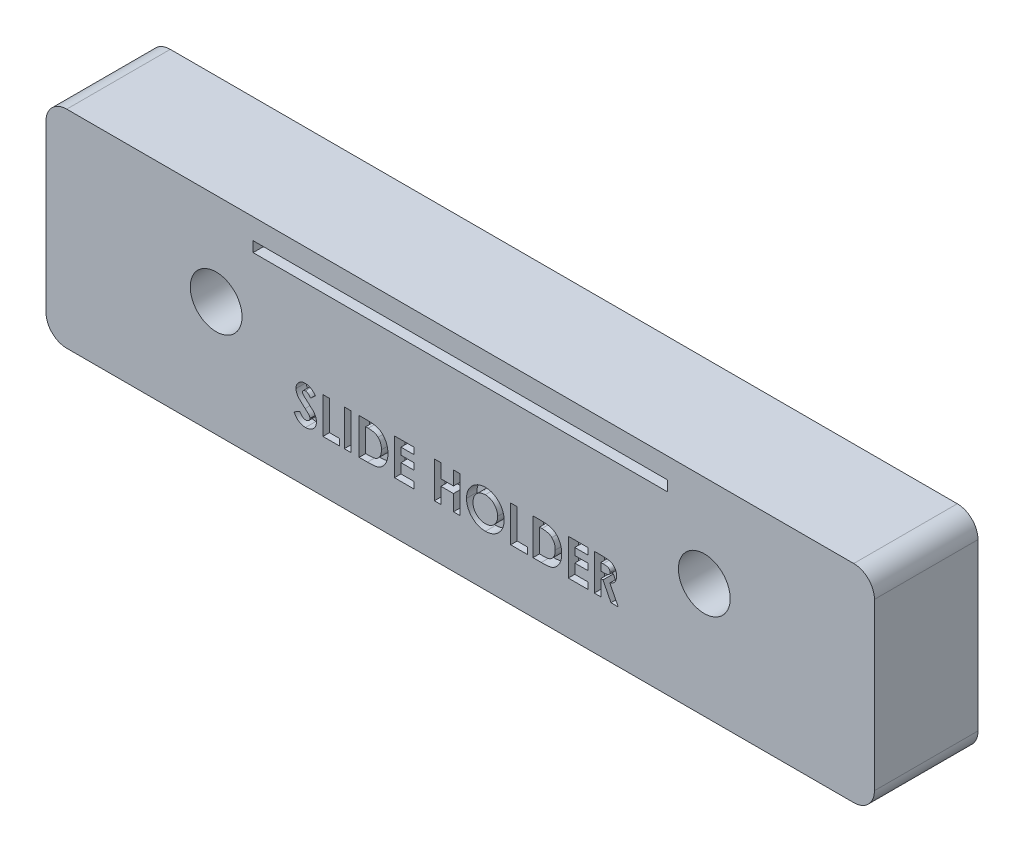
from build123d import *

# Parameters (mm, degrees)
SKETCH1_W           = 80
SKETCH1_H           = 20
BOSS_EXTRUDE1_DEPTH = 10
SKETCH2_R           = 2.5
CUT_EXTRUDE1_DEPTH  = 10
SKETCH3_W           = 40
SKETCH3_H           = 1
CUT_EXTRUDE2_DEPTH  = 47.813641243
SKETCH4_W           = 0.628205128
SKETCH4_H           = 3.5
CUT_EXTRUDE3_DEPTH  = 1
FILLET1_R           = 2


with BuildPart() as part:
    # Sketch1 → Boss-Extrude1 (new body)
    with BuildSketch(Plane.XY):
        with Locations((-0.372188153, 11.484958231)):
            Rectangle(SKETCH1_W, SKETCH1_H)
    extrude(amount=BOSS_EXTRUDE1_DEPTH)

    # Sketch2 → Cut-Extrude1 (cut)
    with BuildSketch(Plane.XY.offset(10)):
        with Locations((-23.942188153, 12.584958231)):
            Circle(SKETCH2_R)
        with Locations(Location((23.197811847, 12.584958231, 0), (0, 0, 180))):
            Circle(SKETCH2_R)
    extrude(amount=-CUT_EXTRUDE1_DEPTH, mode=Mode.SUBTRACT)

    # Sketch3 → Cut-Extrude2 (cut, through all)
    with BuildSketch(Plane.XY.offset(10)):
        with Locations((-0.372188153, 18.984958231)):
            Rectangle(SKETCH3_W, SKETCH3_H)
    extrude(amount=-CUT_EXTRUDE2_DEPTH, mode=Mode.SUBTRACT)

    # Sketch4 → Cut-Extrude3 (cut)
    # profile 1 of 11: a face of its own
    with BuildSketch(Plane.XY.offset(10)):
        with BuildLine():
            Line((-14.349752255, 9.517309993), (-14.819503858, 9.087522333))
            add(Edge.make_bspline(
                [(-14.819503858, 9.087522333), (-14.839626002, 9.11590671), (-14.878257713, 9.170400754), (-14.940875688, 9.243369565), (-15.00321091, 9.30561739), (-15.065840877, 9.356884188), (-15.129320719, 9.396858475), (-15.193540243, 9.425160711), (-15.25813537, 9.443152712), (-15.301533325, 9.445393148), (-15.322909306, 9.446496692)],
                knots=[0, 0, 0, 0, 1.299362458, 2.494594718, 3.587462134, 4.587049575, 5.512617175, 6.380583204, 7.202344345, 8, 8, 8, 8], degree=3))
            add(Edge.make_bspline(
                [(-15.322909306, 9.446496692), (-15.342848209, 9.445797436), (-15.381344991, 9.444447357), (-15.43622501, 9.431027668), (-15.484948273, 9.407867256), (-15.527467227, 9.377583068), (-15.561148512, 9.341097643), (-15.588040406, 9.302833813), (-15.603182803, 9.260599199), (-15.60517584, 9.231590762), (-15.606162511, 9.217229865)],
                knots=[0, 0, 0, 0, 1.185010067, 2.2879431, 3.333075148, 4.379039566, 5.372662701, 6.27520591, 7.14612461, 8, 8, 8, 8], degree=3))
            add(Edge.make_bspline(
                [(-15.606162511, 9.217229865), (-15.605544214, 9.202661878), (-15.60429905, 9.173323975), (-15.592272456, 9.130325625), (-15.574144945, 9.088311232), (-15.556823368, 9.062735072), (-15.547969403, 9.049661756)],
                knots=[0, 0, 0, 0, 0.967525499, 1.948461899, 2.951351359, 4, 4, 4, 4], degree=3))
            add(Edge.make_bspline(
                [(-15.547969403, 9.049661756), (-15.53992019, 9.039500005), (-15.521391965, 9.016108994), (-15.486062436, 8.97906128), (-15.441695968, 8.933674587), (-15.386585244, 8.881509632), (-15.323018063, 8.820690357), (-15.248048005, 8.753607592), (-15.163833033, 8.678183861), (-15.103974983, 8.625661507), (-15.072608826, 8.59813932)],
                knots=[0, 0, 0, 0, 0.473873513, 1.090794244, 1.870441696, 2.795289791, 3.865433203, 5.087734844, 6.473946851, 8, 8, 8, 8], degree=3))
            add(Edge.make_bspline(
                [(-15.072608826, 8.59813932), (-15.043167175, 8.572659057), (-14.987293039, 8.524302811), (-14.907795239, 8.455668883), (-14.837929914, 8.393920612), (-14.776679284, 8.339984707), (-14.724971849, 8.293295256), (-14.682590231, 8.253629086), (-14.649016812, 8.221758422), (-14.629932288, 8.202508522), (-14.621787511, 8.194293166)],
                knots=[0, 0, 0, 0, 1.543621617, 2.929473131, 4.163658386, 5.240097082, 6.164993805, 6.925417477, 7.541396219, 8, 8, 8, 8], degree=3))
            add(Edge.make_bspline(
                [(-14.621787511, 8.194293166), (-14.590887927, 8.160853198), (-14.531488074, 8.096569836), (-14.454289205, 7.996950841), (-14.390752039, 7.899702389), (-14.341598483, 7.802994593), (-14.30447574, 7.705432152), (-14.278303714, 7.604622352), (-14.262629114, 7.499511794), (-14.260888867, 7.42778667), (-14.260008665, 7.391508711)],
                knots=[0, 0, 0, 0, 1.206664779, 2.319633467, 3.337109185, 4.282041471, 5.190008762, 6.099243693, 7.03861361, 8, 8, 8, 8], degree=3))
            add(Edge.make_bspline(
                [(-14.260008665, 7.391508711), (-14.260635171, 7.35616029), (-14.261864397, 7.286805371), (-14.276920065, 7.185314779), (-14.298388563, 7.088183877), (-14.331582628, 6.996469588), (-14.372039357, 6.908666449), (-14.422757711, 6.826142153), (-14.482319463, 6.748061522), (-14.550586376, 6.675820342), (-14.626097688, 6.610266479), (-14.707090746, 6.551908881), (-14.794357542, 6.50372725), (-14.887152482, 6.464053114), (-14.985425894, 6.433495565), (-15.089060706, 6.410910687), (-15.198215434, 6.3973556), (-15.27285701, 6.395938576), (-15.310990236, 6.395214641)],
                knots=[0, 0, 0, 0, 1.043214005, 2.046824704, 3.02475056, 3.976699089, 4.921714032, 5.875962561, 6.831408892, 7.817874052, 8.806269674, 9.781291748, 10.760897367, 11.74438705, 12.757449933, 13.795994037, 14.874007457, 16, 16, 16, 16], degree=3))
            add(Edge.make_bspline(
                [(-15.310990236, 6.395214641), (-15.340924494, 6.395745695), (-15.400211491, 6.396797485), (-15.487591563, 6.405384482), (-15.5719669, 6.419242981), (-15.65324246, 6.43910635), (-15.731784406, 6.464275933), (-15.807595962, 6.495019614), (-15.880153776, 6.531813909), (-15.950006855, 6.57390218), (-16.016815626, 6.622772208), (-16.081424861, 6.677424859), (-16.143192799, 6.738700717), (-16.202416099, 6.806454866), (-16.258715834, 6.88087917), (-16.313934896, 6.960937133), (-16.365619184, 7.048114521), (-16.397546867, 7.109270164), (-16.413854819, 7.140507109)],
                knots=[0, 0, 0, 0, 1.016823716, 2.013894106, 2.979844003, 3.91962641, 4.853723003, 5.779685073, 6.695824784, 7.614987388, 8.547259901, 9.504950863, 10.487499108, 11.500346958, 12.559593716, 13.656357062, 14.802919212, 16, 16, 16, 16], degree=3))
            Line((-16.413854819, 7.140507109), (-15.861370845, 7.472137718))
            add(Edge.make_bspline(
                [(-15.861370845, 7.472137718), (-15.840972034, 7.436679704), (-15.801865771, 7.368703661), (-15.735596552, 7.277369232), (-15.66770712, 7.199156412), (-15.596627932, 7.135447618), (-15.523223285, 7.085390981), (-15.447138618, 7.049617036), (-15.368320474, 7.027473004), (-15.314633135, 7.024768707), (-15.287853217, 7.023419769)],
                knots=[0, 0, 0, 0, 1.283663364, 2.460892379, 3.537111102, 4.529833553, 5.449777664, 6.316464042, 7.160231139, 8, 8, 8, 8], degree=3))
            add(Edge.make_bspline(
                [(-15.287853217, 7.023419769), (-15.260614206, 7.024521385), (-15.207766557, 7.026658679), (-15.132333302, 7.046400227), (-15.063173237, 7.077395904), (-15.003391788, 7.121622461), (-14.952772626, 7.17266663), (-14.915412779, 7.229455602), (-14.891943071, 7.290899899), (-14.889461754, 7.333583149), (-14.888213794, 7.355050378)],
                knots=[0, 0, 0, 0, 1.13588714, 2.203786484, 3.234766741, 4.283437687, 5.291419208, 6.222934724, 7.106237994, 8, 8, 8, 8], degree=3))
            add(Edge.make_bspline(
                [(-14.888213794, 7.355050378), (-14.889366234, 7.375022141), (-14.891707306, 7.415592866), (-14.908950922, 7.475915011), (-14.935907953, 7.536209722), (-14.967800022, 7.585665076), (-15.000254195, 7.627072702), (-15.031287705, 7.662950538), (-15.06907831, 7.702589265), (-15.113530191, 7.746038746), (-15.164056023, 7.793681479), (-15.220698365, 7.845512797), (-15.284105834, 7.901076128), (-15.328922359, 7.938925321), (-15.352356422, 7.958716243)],
                knots=[0, 0, 0, 0, 0.916159276, 1.861089862, 2.860218735, 3.940849679, 4.552606315, 5.27541173, 6.11797699, 7.06649574, 8.129236253, 9.306560635, 10.591630461, 12, 12, 12, 12], degree=3))
            add(Edge.make_bspline(
                [(-15.352356422, 7.958716243), (-15.396905508, 7.996409042), (-15.482408689, 8.068752932), (-15.603235531, 8.175602581), (-15.712111335, 8.275463367), (-15.808095732, 8.36956979), (-15.892411711, 8.456183922), (-15.964488248, 8.536009275), (-16.023533551, 8.609661594), (-16.085665999, 8.696897837), (-16.144704248, 8.803201193), (-16.195730049, 8.931096453), (-16.228833434, 9.058975486), (-16.232542208, 9.144826424), (-16.23436764, 9.187081628)],
                knots=[0, 0, 0, 0, 1.345494975, 2.582412109, 3.71882943, 4.751509156, 5.681369928, 6.505683931, 7.230279997, 7.856715994, 8.973648664, 10.023341002, 11.027102913, 12, 12, 12, 12], degree=3))
            add(Edge.make_bspline(
                [(-16.23436764, 9.187081628), (-16.233608445, 9.21704675), (-16.232112751, 9.27608126), (-16.218770923, 9.362882906), (-16.198831054, 9.4466392), (-16.169872639, 9.527044562), (-16.132288114, 9.603998281), (-16.086643167, 9.677877078), (-16.03222902, 9.748000989), (-15.97090795, 9.814323527), (-15.903347831, 9.87493478), (-15.831151258, 9.928430283), (-15.75472687, 9.973613363), (-15.674542192, 10.011096009), (-15.590100355, 10.039786593), (-15.502023437, 10.060123909), (-15.410185107, 10.072219896), (-15.347718657, 10.073864205), (-15.315898088, 10.07470182)],
                knots=[0, 0, 0, 0, 1.010766082, 1.991317756, 2.957454644, 3.913069143, 4.869106762, 5.843196583, 6.838735724, 7.860187025, 8.887984031, 9.89767229, 10.887916223, 11.879572884, 12.879850636, 13.892031539, 14.926195476, 16, 16, 16, 16], degree=3))
            add(Edge.make_bspline(
                [(-15.315898088, 10.07470182), (-15.274660206, 10.073193251), (-15.192509958, 10.07018802), (-15.071048447, 10.046688095), (-14.952409922, 10.009731987), (-14.856808774, 9.965148509), (-14.780740726, 9.921960473), (-14.722441673, 9.882198369), (-14.663119248, 9.836648743), (-14.602295053, 9.785168054), (-14.541099296, 9.72678634), (-14.477791889, 9.662893423), (-14.413235472, 9.592937118), (-14.371284036, 9.542960658), (-14.349752255, 9.517309993)],
                knots=[0, 0, 0, 0, 1.282922637, 2.555718331, 3.837320111, 5.142675274, 5.830281639, 6.55870424, 7.337177975, 8.157850921, 9.037902056, 9.96903443, 10.957596896, 12, 12, 12, 12], degree=3))
        make_face()
    # profile 2 of 11: a face of its own
    with BuildSketch(Plane.XY.offset(10)):
        Polygon((-13.631803537, 9.984958231), (-13.003598409, 9.984958231), (-13.003598409, 7.113163359), (-12.016418922, 7.113163359), (-12.016418922, 6.484958231), (-13.631803537, 6.484958231), align=None)
    # profile 3 of 11: a face of its own
    with BuildSketch(Plane.XY.offset(10)):
        with Locations((-11.253598409, 8.234958231)):
            Rectangle(SKETCH4_W, SKETCH4_H)
    # profile 4 of 11: a face of its own
    with BuildSketch(Plane.XY.offset(10)):
        with BuildLine():
            Line((-10.131803537, 9.984958231), (-9.340237031, 9.984958231))
            add(Edge.make_bspline(
                [(-9.340237031, 9.984958231), (-9.278525317, 9.984526845), (-9.159235876, 9.983692971), (-8.986409077, 9.974297216), (-8.825702145, 9.959847212), (-8.677011488, 9.939968613), (-8.540641944, 9.913663783), (-8.41676936, 9.880669529), (-8.304977988, 9.842583152), (-8.204042061, 9.797766801), (-8.111897268, 9.745515387), (-8.024402846, 9.687311506), (-7.941730589, 9.621022981), (-7.862720321, 9.547928649), (-7.788391688, 9.466691271), (-7.717506852, 9.378656434), (-7.651801394, 9.282547511), (-7.589289181, 9.18066889), (-7.532755202, 9.07258882), (-7.483444154, 8.959227255), (-7.44213599, 8.841313719), (-7.408570967, 8.718722549), (-7.38181577, 8.591860707), (-7.363095698, 8.460472201), (-7.351522763, 8.324678672), (-7.350348786, 8.232644731), (-7.349752255, 8.185879705)],
                knots=[0, 0, 0, 0, 1.44355588, 2.790409838, 4.047694926, 5.217575253, 6.298404546, 7.294384826, 8.214239204, 9.058592145, 9.873746385, 10.689560431, 11.514393297, 12.350027578, 13.205127629, 14.088021785, 14.991911688, 15.926770944, 16.882954281, 17.842803888, 18.816321264, 19.80318086, 20.814351908, 21.847355356, 22.906180909, 24, 24, 24, 24], degree=3))
            add(Edge.make_bspline(
                [(-7.349752255, 8.185879705), (-7.351314295, 8.119891209), (-7.354389262, 7.989988993), (-7.380291065, 7.799358988), (-7.422183052, 7.616621114), (-7.48108699, 7.44320482), (-7.554112105, 7.280654401), (-7.641348783, 7.131836367), (-7.741517929, 6.997549498), (-7.853452569, 6.878462432), (-7.974650522, 6.776105485), (-8.100599634, 6.68844425), (-8.232526881, 6.619316051), (-8.348773223, 6.575478436), (-8.449573303, 6.548215232), (-8.538074683, 6.532102416), (-8.638603221, 6.517325992), (-8.752096258, 6.505907089), (-8.878055925, 6.495724234), (-9.016984298, 6.490191267), (-9.168431567, 6.485594192), (-9.273626014, 6.485175772), (-9.32831796, 6.484958231)],
                knots=[0, 0, 0, 0, 1.315458931, 2.589557908, 3.828601765, 5.048913369, 6.235739168, 7.376350998, 8.481830359, 9.569842114, 10.627874879, 11.640079404, 12.624025415, 13.590060155, 14.111227486, 14.704434459, 15.382649715, 16.137166398, 16.978595427, 17.902333227, 18.909396075, 20, 20, 20, 20], degree=3))
            Line((-9.32831796, 6.484958231), (-10.131803537, 6.484958231))
            Line((-10.131803537, 6.484958231), (-10.131803537, 9.984958231))
        make_face()
        with BuildLine():
            Line((-9.503598409, 9.356753102), (-9.503598409, 7.113163359))
            Line((-9.503598409, 7.113163359), (-9.175473409, 7.113163359))
            add(Edge.make_bspline(
                [(-9.175473409, 7.113163359), (-9.136431573, 7.1132349), (-9.061341126, 7.113372496), (-8.952927517, 7.11992635), (-8.852672419, 7.126504612), (-8.760851809, 7.138990373), (-8.676797445, 7.152898632), (-8.601664016, 7.172253879), (-8.533902693, 7.192584927), (-8.474341169, 7.21846887), (-8.419787665, 7.247602971), (-8.369277353, 7.281736947), (-8.320520759, 7.319641441), (-8.274429429, 7.362431277), (-8.230828917, 7.409539837), (-8.189977191, 7.461209851), (-8.15132899, 7.517283672), (-8.115876339, 7.578057777), (-8.083479517, 7.642890377), (-8.054739905, 7.711153473), (-8.030910527, 7.783415551), (-8.011105006, 7.85900015), (-7.996951715, 7.93856532), (-7.985242567, 8.021521734), (-7.97920616, 8.108198056), (-7.978377701, 8.167175523), (-7.977957383, 8.197097654)],
                knots=[0, 0, 0, 0, 1.50275155, 2.890291501, 4.180787663, 5.369391935, 6.45668281, 7.458360028, 8.354766181, 9.177074746, 9.954075863, 10.732690366, 11.5210699, 12.329727389, 13.151100085, 13.990027547, 14.863562427, 15.770965086, 16.696477834, 17.652329173, 18.619756807, 19.62365428, 20.657822005, 21.729286259, 22.847956731, 24, 24, 24, 24], degree=3))
            add(Edge.make_bspline(
                [(-7.977957383, 8.197097654), (-7.978794513, 8.24295049), (-7.980426852, 8.332359969), (-7.996168771, 8.462586827), (-8.021793612, 8.585214922), (-8.058357792, 8.699789149), (-8.104448074, 8.806631522), (-8.162140805, 8.90483686), (-8.228953114, 8.996054876), (-8.281786464, 9.049566291), (-8.308185749, 9.076304384)],
                knots=[0, 0, 0, 0, 1.13821349, 2.219428113, 3.251817212, 4.244760574, 5.201143372, 6.134805572, 7.068016741, 8, 8, 8, 8], degree=3))
            add(Edge.make_bspline(
                [(-8.308185749, 9.076304384), (-8.334217943, 9.099088855), (-8.387385752, 9.145623556), (-8.480730952, 9.201384028), (-8.583592529, 9.250375068), (-8.698323646, 9.289219499), (-8.823815478, 9.319939331), (-8.960815458, 9.341126048), (-9.10858992, 9.354740408), (-9.210964624, 9.356067831), (-9.263814755, 9.356753102)],
                knots=[0, 0, 0, 0, 0.813307809, 1.661089106, 2.549956539, 3.493439533, 4.508053171, 5.589449661, 6.755572447, 8, 8, 8, 8], degree=3))
            Line((-9.263814755, 9.356753102), (-9.503598409, 9.356753102))
        make_face(mode=Mode.SUBTRACT)
    # profile 5 of 11: a face of its own
    with BuildSketch(Plane.XY.offset(10)):
        Polygon((-6.721547127, 9.984958231), (-4.836931742, 9.984958231), (-4.836931742, 9.356753102), (-6.093341999, 9.356753102), (-6.093341999, 8.683676179), (-4.836931742, 8.683676179), (-4.836931742, 8.055471051), (-6.093341999, 8.055471051), (-6.093341999, 7.113163359), (-4.836931742, 7.113163359), (-4.836931742, 6.484958231), (-6.721547127, 6.484958231), align=None)
    # profile 6 of 11: a face of its own
    with BuildSketch(Plane.XY.offset(10)):
        Polygon((-2.862572768, 9.984958231), (-2.23436764, 9.984958231), (-2.23436764, 8.638804384), (-1.022829178, 8.638804384), (-1.022829178, 9.984958231), (-0.39462405, 9.984958231), (-0.39462405, 6.484958231), (-1.022829178, 6.484958231), (-1.022829178, 8.010599256), (-2.23436764, 8.010599256), (-2.23436764, 6.484958231), (-2.862572768, 6.484958231), align=None)
    # profile 7 of 11: a face of its own
    with BuildSketch(Plane.XY.offset(10)):
        with BuildLine():
            add(Edge.make_bspline(
                [(2.057899989, 10.07470182), (2.118751778, 10.073126259), (2.238886993, 10.070015743), (2.415562542, 10.044087165), (2.585822101, 10.001840266), (2.749588678, 9.94311402), (2.906452222, 9.866317822), (3.056966042, 9.773628896), (3.200591005, 9.663297792), (3.335855357, 9.537898354), (3.460864014, 9.40153194), (3.569184088, 9.254709252), (3.661555474, 9.101234612), (3.738113125, 8.940696782), (3.796426027, 8.771983959), (3.837346602, 8.595956357), (3.863636044, 8.412664053), (3.866659734, 8.287866977), (3.868196463, 8.224441404)],
                knots=[0, 0, 0, 0, 1.014329547, 2.002516266, 2.970391464, 3.935626869, 4.897733899, 5.877609409, 6.878433252, 7.912639331, 8.949961323, 9.958554974, 10.949718813, 11.932905612, 12.9188844, 13.919928257, 14.942845884, 16, 16, 16, 16], degree=3))
            add(Edge.make_bspline(
                [(3.868196463, 8.224441404), (3.866559913, 8.16173049), (3.863335039, 8.038156623), (3.838419852, 7.85655343), (3.796810169, 7.68241145), (3.7394863, 7.515336509), (3.664317115, 7.35613786), (3.573747072, 7.203799042), (3.4653862, 7.059733797), (3.343186846, 6.924019434), (3.208655961, 6.800829529), (3.066166398, 6.692268638), (2.916376085, 6.600278235), (2.759504267, 6.524900457), (2.595214541, 6.46640254), (2.423912721, 6.425128009), (2.245609409, 6.400044643), (2.124354509, 6.396840833), (2.062807841, 6.395214641)],
                knots=[0, 0, 0, 0, 1.051557043, 2.072126891, 3.067553643, 4.050577992, 5.02905126, 6.015227836, 7.017913613, 8.04756643, 9.074058332, 10.072836633, 11.047628519, 12.017157415, 12.98668631, 13.966869689, 14.968021931, 16, 16, 16, 16], degree=3))
            add(Edge.make_bspline(
                [(2.062807841, 6.395214641), (1.998437406, 6.396673416), (1.871958299, 6.399539709), (1.68685556, 6.426796848), (1.509511142, 6.467855622), (1.34141484, 6.529133638), (1.180854737, 6.605736312), (1.029010515, 6.700077097), (0.885933204, 6.812000088), (0.752443519, 6.938638896), (0.63150154, 7.077209529), (0.524746521, 7.223597113), (0.434696295, 7.376683378), (0.361347566, 7.53653997), (0.303522374, 7.70217342), (0.262733272, 7.874592483), (0.238638176, 8.053383636), (0.235281869, 8.174822161), (0.233581078, 8.236360474)],
                knots=[0, 0, 0, 0, 1.067978421, 2.098431617, 3.099715153, 4.085208694, 5.062210972, 6.048429807, 7.046490867, 8.072918869, 9.098532598, 10.095778865, 11.076610158, 12.041847152, 13.011192615, 13.984257998, 14.978533688, 16, 16, 16, 16], degree=3))
            add(Edge.make_bspline(
                [(0.233581078, 8.236360474), (0.234114884, 8.27776023), (0.235175737, 8.360035525), (0.247954826, 8.481963312), (0.26635304, 8.601511233), (0.293563126, 8.718202648), (0.326616426, 8.832860761), (0.369441644, 8.944418305), (0.418188333, 9.054067022), (0.475144249, 9.160511823), (0.53847372, 9.262773328), (0.607571811, 9.36036915), (0.682612269, 9.452119214), (0.763353364, 9.538626463), (0.850073339, 9.619322279), (0.941631484, 9.695349023), (1.039803493, 9.764687155), (1.142440689, 9.829030051), (1.248964427, 9.887214215), (1.358941058, 9.936738836), (1.470104848, 9.979987843), (1.583940794, 10.014121873), (1.699228942, 10.041923682), (1.817200912, 10.060309496), (1.936790894, 10.073088231), (2.017434485, 10.074162681), (2.057899989, 10.07470182)],
                knots=[0, 0, 0, 0, 1.034744296, 2.056386356, 3.06226378, 4.057406941, 5.050368692, 6.043467995, 7.042652155, 8.049140477, 9.059438543, 10.048523776, 11.036952808, 12.020949711, 13.004946614, 13.997082645, 14.994316842, 16.007702937, 17.024872941, 18.026463647, 19.021641123, 20.005082605, 20.995858141, 21.984425357, 22.988620895, 24, 24, 24, 24], degree=3))
        make_face()
        with BuildLine():
            add(Edge.make_bspline(
                [(2.048084283, 9.446496692), (2.007131037, 9.445397825), (1.926305717, 9.4432291), (1.807749692, 9.42670635), (1.693931721, 9.40031764), (1.585482743, 9.362093917), (1.481932729, 9.313444819), (1.383098118, 9.254540331), (1.290347565, 9.183355678), (1.20244433, 9.103712446), (1.123038223, 9.014971583), (1.052880422, 8.919870656), (0.994169643, 8.818568482), (0.944998997, 8.712006135), (0.907984399, 8.598985349), (0.881620011, 8.480391428), (0.864958701, 8.356020029), (0.862858522, 8.271236208), (0.861786206, 8.227947013)],
                knots=[0, 0, 0, 0, 1.033739768, 2.040188636, 3.016340934, 3.979330865, 4.937572243, 5.900995986, 6.878200029, 7.884839167, 8.891893314, 9.879764717, 10.863503415, 11.843163062, 12.837761627, 13.859916423, 14.907309254, 16, 16, 16, 16], degree=3))
            add(Edge.make_bspline(
                [(0.861786206, 8.227947013), (0.863207934, 8.179972846), (0.865994284, 8.085951429), (0.885599381, 7.948795519), (0.919141751, 7.819265375), (0.967576281, 7.697994508), (1.027647806, 7.583636298), (1.102247105, 7.477592367), (1.190166024, 7.379227773), (1.257898046, 7.321798425), (1.292274989, 7.292650538)],
                knots=[0, 0, 0, 0, 1.078454662, 2.113592447, 3.107694534, 4.079536787, 5.043276885, 6.005368276, 6.987637804, 8, 8, 8, 8], degree=3))
            add(Edge.make_bspline(
                [(1.292274989, 7.292650538), (1.320436267, 7.271117199), (1.376124346, 7.22853567), (1.465014644, 7.173958705), (1.556554147, 7.127180801), (1.651433636, 7.089384809), (1.749452731, 7.059655117), (1.85059799, 7.038835902), (1.954726098, 7.025770044), (2.025142405, 7.024208427), (2.060704476, 7.023419769)],
                knots=[0, 0, 0, 0, 1.023928204, 2.024787132, 3.009472467, 3.9914905, 4.972207045, 5.96565515, 6.972602802, 8, 8, 8, 8], degree=3))
            add(Edge.make_bspline(
                [(2.060704476, 7.023419769), (2.10095353, 7.024527954), (2.18014481, 7.026708342), (2.29649385, 7.043027688), (2.407959765, 7.070645913), (2.515234544, 7.108534324), (2.618008854, 7.157794254), (2.715780409, 7.218525774), (2.80872063, 7.28998318), (2.896511877, 7.370672302), (2.976757226, 7.459762743), (3.046768622, 7.555370928), (3.107346111, 7.655390324), (3.155494252, 7.761236552), (3.193971213, 7.871910475), (3.220018293, 7.987902243), (3.236820353, 8.108733694), (3.238921123, 8.190963766), (3.239991335, 8.232854865)],
                knots=[0, 0, 0, 0, 1.026359118, 2.019393844, 2.989460624, 3.950973911, 4.916101784, 5.890408035, 6.881132271, 7.902007068, 8.92769091, 9.933912415, 10.920395702, 11.90457117, 12.894218921, 13.903490204, 14.931958862, 16, 16, 16, 16], degree=3))
            add(Edge.make_bspline(
                [(3.239991335, 8.232854865), (3.238884094, 8.274505079), (3.236704658, 8.356487173), (3.220356589, 8.477007967), (3.192913512, 8.592487665), (3.154911326, 8.703114858), (3.106384547, 8.808998001), (3.046376261, 8.909764747), (2.975097031, 9.005317679), (2.894187343, 9.095005641), (2.806122121, 9.177423132), (2.711575305, 9.248946533), (2.613192423, 9.311098094), (2.50871609, 9.359785117), (2.400283804, 9.398573965), (2.287233907, 9.427138629), (2.169138215, 9.443113027), (2.088795273, 9.44535875), (2.048084283, 9.446496692)],
                knots=[0, 0, 0, 0, 1.055025985, 2.07665775, 3.074803781, 4.057872707, 5.035505728, 6.020516407, 7.023567878, 8.050795229, 9.077271434, 10.074415901, 11.050397877, 12.019801805, 12.988065821, 13.964604439, 14.968634123, 16, 16, 16, 16], degree=3))
        make_face(mode=Mode.SUBTRACT)
    # profile 8 of 11: a face of its own
    with BuildSketch(Plane.XY.offset(10)):
        Polygon((4.496401591, 9.984958231), (5.124606719, 9.984958231), (5.124606719, 7.113163359), (6.111786206, 7.113163359), (6.111786206, 6.484958231), (4.496401591, 6.484958231), align=None)
    # profile 9 of 11: a face of its own
    with BuildSketch(Plane.XY.offset(10)):
        with BuildLine():
            Line((6.650247745, 9.984958231), (7.441814251, 9.984958231))
            add(Edge.make_bspline(
                [(7.441814251, 9.984958231), (7.503525965, 9.984526845), (7.622815406, 9.983692971), (7.795642205, 9.974297216), (7.956349137, 9.959847212), (8.105039794, 9.939968613), (8.241409338, 9.913663783), (8.365281923, 9.880669529), (8.477073294, 9.842583152), (8.578009221, 9.797766801), (8.670154014, 9.745515387), (8.757648436, 9.687311506), (8.840320693, 9.621022981), (8.919330961, 9.547928649), (8.993659594, 9.466691271), (9.06454443, 9.378656434), (9.130249888, 9.282547511), (9.192762101, 9.18066889), (9.24929608, 9.07258882), (9.298607128, 8.959227255), (9.339915292, 8.841313719), (9.373480315, 8.718722549), (9.400235512, 8.591860707), (9.418955584, 8.460472201), (9.430528519, 8.324678672), (9.431702496, 8.232644731), (9.432299027, 8.185879705)],
                knots=[0, 0, 0, 0, 1.44355588, 2.790409838, 4.047694926, 5.217575253, 6.298404546, 7.294384826, 8.214239204, 9.058592145, 9.873746385, 10.689560431, 11.514393297, 12.350027578, 13.205127629, 14.088021785, 14.991911688, 15.926770944, 16.882954281, 17.842803888, 18.816321264, 19.80318086, 20.814351908, 21.847355356, 22.906180909, 24, 24, 24, 24], degree=3))
            add(Edge.make_bspline(
                [(9.432299027, 8.185879705), (9.430736987, 8.119891209), (9.42766202, 7.989988993), (9.401760217, 7.799358988), (9.35986823, 7.616621114), (9.300964292, 7.44320482), (9.227939177, 7.280654401), (9.140702499, 7.131836367), (9.040533353, 6.997549498), (8.928598713, 6.878462432), (8.80740076, 6.776105485), (8.681451648, 6.68844425), (8.549524401, 6.619316051), (8.43327806, 6.575478436), (8.332477979, 6.548215232), (8.243976599, 6.532102416), (8.143448061, 6.517325992), (8.029955024, 6.505907089), (7.903995357, 6.495724234), (7.765066984, 6.490191267), (7.613619715, 6.485594192), (7.508425268, 6.485175772), (7.453733322, 6.484958231)],
                knots=[0, 0, 0, 0, 1.315458931, 2.589557908, 3.828601765, 5.048913369, 6.235739168, 7.376350998, 8.481830359, 9.569842114, 10.627874879, 11.640079404, 12.624025415, 13.590060155, 14.111227486, 14.704434459, 15.382649715, 16.137166398, 16.978595427, 17.902333227, 18.909396075, 20, 20, 20, 20], degree=3))
            Line((7.453733322, 6.484958231), (6.650247745, 6.484958231))
            Line((6.650247745, 6.484958231), (6.650247745, 9.984958231))
        make_face()
        with BuildLine():
            Line((7.278452873, 9.356753102), (7.278452873, 7.113163359))
            Line((7.278452873, 7.113163359), (7.606577873, 7.113163359))
            add(Edge.make_bspline(
                [(7.606577873, 7.113163359), (7.645619709, 7.1132349), (7.720710156, 7.113372496), (7.829123765, 7.11992635), (7.929378863, 7.126504612), (8.021199473, 7.138990373), (8.105253837, 7.152898632), (8.180387267, 7.172253879), (8.248148589, 7.192584927), (8.307710113, 7.21846887), (8.362263617, 7.247602971), (8.412773929, 7.281736947), (8.461530523, 7.319641441), (8.507621853, 7.362431277), (8.551222365, 7.409539837), (8.592074091, 7.461209851), (8.630722292, 7.517283672), (8.666174943, 7.578057777), (8.698571765, 7.642890377), (8.727311377, 7.711153473), (8.751140756, 7.783415551), (8.770946276, 7.85900015), (8.785099567, 7.93856532), (8.796808715, 8.021521734), (8.802845122, 8.108198056), (8.803673581, 8.167175523), (8.804093899, 8.197097654)],
                knots=[0, 0, 0, 0, 1.50275155, 2.890291501, 4.180787663, 5.369391935, 6.45668281, 7.458360028, 8.354766181, 9.177074746, 9.954075863, 10.732690366, 11.5210699, 12.329727389, 13.151100085, 13.990027547, 14.863562427, 15.770965086, 16.696477834, 17.652329173, 18.619756807, 19.62365428, 20.657822005, 21.729286259, 22.847956731, 24, 24, 24, 24], degree=3))
            add(Edge.make_bspline(
                [(8.804093899, 8.197097654), (8.803256769, 8.24295049), (8.80162443, 8.332359969), (8.785882511, 8.462586827), (8.76025767, 8.585214922), (8.72369349, 8.699789149), (8.677603208, 8.806631522), (8.619910477, 8.90483686), (8.553098168, 8.996054876), (8.500264818, 9.049566291), (8.473865533, 9.076304384)],
                knots=[0, 0, 0, 0, 1.13821349, 2.219428113, 3.251817212, 4.244760574, 5.201143372, 6.134805572, 7.068016741, 8, 8, 8, 8], degree=3))
            add(Edge.make_bspline(
                [(8.473865533, 9.076304384), (8.447833339, 9.099088855), (8.39466553, 9.145623556), (8.30132033, 9.201384028), (8.198458753, 9.250375068), (8.083727636, 9.289219499), (7.958235804, 9.319939331), (7.821235824, 9.341126048), (7.673461363, 9.354740408), (7.571086658, 9.356067831), (7.518236527, 9.356753102)],
                knots=[0, 0, 0, 0, 0.813307809, 1.661089106, 2.549956539, 3.493439533, 4.508053171, 5.589449661, 6.755572447, 8, 8, 8, 8], degree=3))
            Line((7.518236527, 9.356753102), (7.278452873, 9.356753102))
        make_face(mode=Mode.SUBTRACT)
    # profile 10 of 11: a face of its own
    with BuildSketch(Plane.XY.offset(10)):
        Polygon((10.060504155, 9.984958231), (11.94511954, 9.984958231), (11.94511954, 9.356753102), (10.688709283, 9.356753102), (10.688709283, 8.683676179), (11.94511954, 8.683676179), (11.94511954, 8.055471051), (10.688709283, 8.055471051), (10.688709283, 7.113163359), (11.94511954, 7.113163359), (11.94511954, 6.484958231), (10.060504155, 6.484958231), align=None)
    # profile 11 of 11: a face of its own
    with BuildSketch(Plane.XY.offset(10)):
        with BuildLine():
            Line((12.573324668, 9.984958231), (13.305295822, 9.984958231))
            add(Edge.make_bspline(
                [(13.305295822, 9.984958231), (13.353678892, 9.984786498), (13.446733166, 9.984456209), (13.580912345, 9.979245119), (13.704174374, 9.97199346), (13.816701753, 9.960927236), (13.918446342, 9.946254761), (14.009510111, 9.92895834), (14.089890399, 9.90924536), (14.160265103, 9.884681432), (14.223774794, 9.856973694), (14.282974655, 9.825136994), (14.339170723, 9.789525846), (14.39198739, 9.749203222), (14.441883643, 9.704894517), (14.488953615, 9.65655513), (14.532532163, 9.603775162), (14.572349449, 9.546888118), (14.608639699, 9.487044251), (14.640712669, 9.424161396), (14.666794462, 9.358195823), (14.689840521, 9.290100876), (14.706439851, 9.218903125), (14.717984443, 9.145295692), (14.726436941, 9.069019471), (14.726922919, 9.017200793), (14.727170822, 8.990767525)],
                knots=[0, 0, 0, 0, 1.749336639, 3.364467119, 4.854658419, 6.213483162, 7.451590619, 8.570285859, 9.5643256, 10.440900261, 11.26203566, 12.067320669, 12.869050712, 13.665104639, 14.467235401, 15.27997916, 16.102287765, 16.939272006, 17.78853747, 18.631303466, 19.488103222, 20.351255419, 21.228522269, 22.127379805, 23.044756219, 24, 24, 24, 24], degree=3))
            add(Edge.make_bspline(
                [(14.727170822, 8.990767525), (14.72652686, 8.963177267), (14.725264167, 8.909077798), (14.718462619, 8.829610091), (14.706031525, 8.753580948), (14.687202824, 8.681212972), (14.665561678, 8.611605459), (14.636784506, 8.546042713), (14.604306622, 8.483571217), (14.565733589, 8.425074654), (14.52340157, 8.3692537), (14.474170322, 8.318247061), (14.421229273, 8.269313325), (14.361602416, 8.225517534), (14.297918157, 8.183898375), (14.228911156, 8.146180334), (14.155031778, 8.111415265), (14.103090916, 8.092027861), (14.076529796, 8.082113679)],
                knots=[0, 0, 0, 0, 1.099860209, 2.156625411, 3.176576793, 4.16617041, 5.135385252, 6.078461593, 7.016046972, 7.938469504, 8.868247731, 9.803980173, 10.76021508, 11.73834243, 12.748633912, 13.790971185, 14.870363756, 16, 16, 16, 16], degree=3))
            Line((14.076529796, 8.082113679), (14.884222104, 6.484958231))
            Line((14.884222104, 6.484958231), (14.185904796, 6.484958231))
            Line((14.185904796, 6.484958231), (13.414670822, 8.010599256))
            Line((13.414670822, 8.010599256), (13.201529796, 8.010599256))
            Line((13.201529796, 8.010599256), (13.201529796, 6.484958231))
            Line((13.201529796, 6.484958231), (12.573324668, 6.484958231))
            Line((12.573324668, 6.484958231), (12.573324668, 9.984958231))
        make_face()
        with BuildLine():
            Line((13.201529796, 8.638804384), (13.446221303, 8.638804384))
            add(Edge.make_bspline(
                [(13.446221303, 8.638804384), (13.476136873, 8.639141314), (13.533418763, 8.639786461), (13.615797644, 8.642778921), (13.690617314, 8.64998927), (13.758199075, 8.659099277), (13.81888299, 8.669618096), (13.872127783, 8.684692203), (13.918753872, 8.700844489), (13.958208738, 8.720917591), (13.991918069, 8.743745062), (14.021023919, 8.769677636), (14.04509863, 8.799691288), (14.064913345, 8.832970378), (14.080327039, 8.869809249), (14.091577855, 8.909803495), (14.097865397, 8.953408702), (14.0985888, 8.983502233), (14.098965694, 8.999180987)],
                knots=[0, 0, 0, 0, 1.688639943, 3.233382647, 4.650958383, 5.928841754, 7.082724185, 8.122798841, 9.049171256, 9.863274652, 10.613301712, 11.341792392, 12.054588806, 12.776240173, 13.521029143, 14.301969904, 15.115324896, 16, 16, 16, 16], degree=3))
            add(Edge.make_bspline(
                [(14.098965694, 8.999180987), (14.098253142, 9.017730098), (14.096853465, 9.05416639), (14.082964328, 9.106621873), (14.060855821, 9.155173012), (14.030551114, 9.19960044), (13.992386275, 9.238548591), (13.948589111, 9.272881696), (13.898214374, 9.300029746), (13.851571158, 9.317936311), (13.809136734, 9.328649994), (13.770841005, 9.336633735), (13.726494321, 9.342292042), (13.676063201, 9.348293684), (13.619676197, 9.352185444), (13.557025966, 9.355025654), (13.488292438, 9.356187723), (13.440378641, 9.356559216), (13.415371944, 9.356753102)],
                knots=[0, 0, 0, 0, 1.020303359, 2.004196876, 2.966617323, 3.9489082, 4.950758222, 5.960522915, 7.003732012, 8.091992268, 8.70421221, 9.413913587, 10.24622431, 11.166358409, 12.212345909, 13.359657661, 14.621978493, 16, 16, 16, 16], degree=3))
            Line((13.415371944, 9.356753102), (13.201529796, 9.356753102))
            Line((13.201529796, 9.356753102), (13.201529796, 8.638804384))
        make_face(mode=Mode.SUBTRACT)
    extrude(amount=-CUT_EXTRUDE3_DEPTH, mode=Mode.SUBTRACT)

    # Fillet1
    fillet1_edges = [part.edges().sort_by_distance(p)[0] for p in [
        (-40.372188153, 21.484958231, 5),
        (39.627811847, 21.484958231, 5),
        (39.627811847, 1.484958231, 5),
        (-40.372188153, 1.484958231, 5),
    ]]
    fillet(fillet1_edges, radius=FILLET1_R)


solid = part.part
